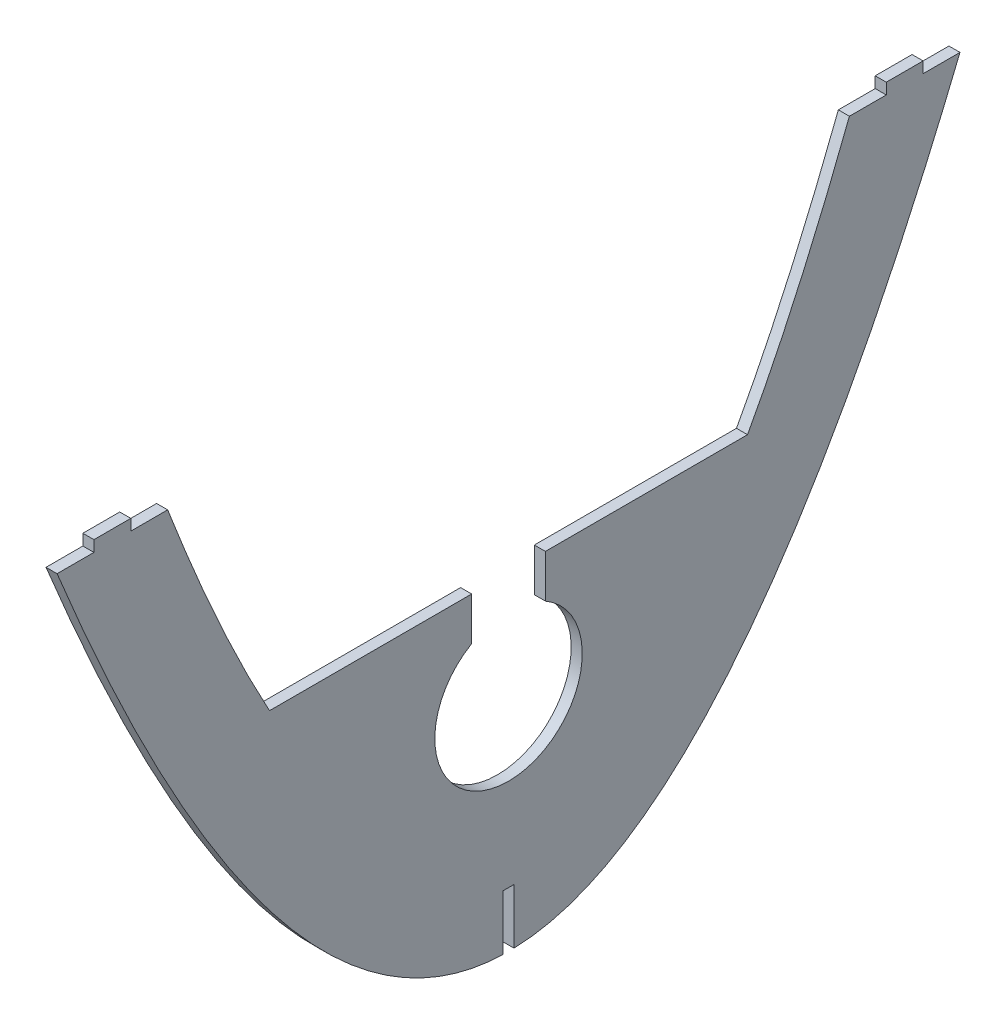
from build123d import *

# Parameters (mm, degrees)
EXTRUDE_1_DEPTH     = 3
EXTRUDE_2_DEPTH     = 3
EXTRUDE_3_DEPTH     = 3
CUT_EXTRUDE_1_DEPTH = 197.006403199


with BuildPart() as part:
    # 草图1 → 凸台-拉伸1 (new body)
    with BuildSketch(Plane(origin=(0, 0, 0), x_dir=(0, 0, -1), z_dir=(1, 0, 0))):
        with BuildLine():
            Line((-122.475, 150.001256251), (-92.475483103, 150.001256251))
            add(Edge.make_bspline(
                [(-92.475483103, 150.001256251), (0, -90.001256251), (92.475483103, 150.001256251)],
                knots=[0.160021058, 0.160021058, 0.160021058, 0.839978942, 0.839978942, 0.839978942], degree=2))
            Line((92.475483103, 150.001256251), (122.475, 150.001256251))
            add(Edge.make_bspline(
                [(-122.475, 150.001256251), (0, -150.001256251), (122.475, 150.001256251)],
                knots=[0.053283855, 0.053283855, 0.053283855, 0.946716145, 0.946716145, 0.946716145], degree=2))
        make_face()
    extrude(amount=EXTRUDE_1_DEPTH)

    # 草图3 → 凸台-拉伸2 (add)
    with BuildSketch(Plane(origin=(0, 150.001256251, 0), x_dir=(1, 0, 0), z_dir=(0, 1, 0))):
        Polygon((3, -102.475241552), (0.999991948, -102.475241552), (2.000008052, -112.475241552), (3, -112.475241552), align=None)
        Polygon((2.000008052, -112.475241552), (0.999991948, -102.475241552), (0, -102.475241552), (0, -112.475241552), align=None)
        Polygon((0.999991948, 102.475241552), (2.000008052, 112.475241552), (0, 112.475241552), (0, 102.475241552), align=None)
        Polygon((3, 112.475241552), (2.000008052, 112.475241552), (0.999991948, 102.475241552), (3, 102.475241552), align=None)
    extrude(amount=EXTRUDE_2_DEPTH)

    # 草图4 → 凸台-拉伸3 (add)
    with BuildSketch(Plane(origin=(3, 0, 0), x_dir=(0, 0, -1), z_dir=(1, 0, 0))):
        with BuildLine():
            Line((-10, 89), (-64.842495169, 89))
            add(Edge.make_bspline(
                [(64.842495169, 89), (0, -29), (-64.842495169, 89)],
                knots=[0, 0, 0, 1, 1, 1], degree=2))
            Line((64.842495169, 89), (10, 89))
            Line((10, 89), (10, 77.320508076))
            ThreePointArc((10, 77.320508076), (0, 40), (-10, 77.320508076))
            Line((-10, 77.320508076), (-10, 89))
        make_face()
    extrude(amount=-EXTRUDE_3_DEPTH)

    # 草图5 → 切除-拉伸1 (cut, through all)
    with BuildSketch(Plane.ZY):
        with BuildLine():
            Line((1.5, 15.007793411), (-1.5, 15.007793411))
            Line((-1.5, 15.007793411), (-1.5, 0.0225))
            add(Edge.make_bspline(
                [(-1.5, 0.0225), (0, -0.0225), (1.5, 0.0225)],
                knots=[0.49452889, 0.49452889, 0.49452889, 0.50547111, 0.50547111, 0.50547111], degree=2))
            Line((1.5, 0.0225), (1.5, 15.007793411))
        make_face()
    extrude(amount=-CUT_EXTRUDE_1_DEPTH, mode=Mode.SUBTRACT)


solid = part.part
